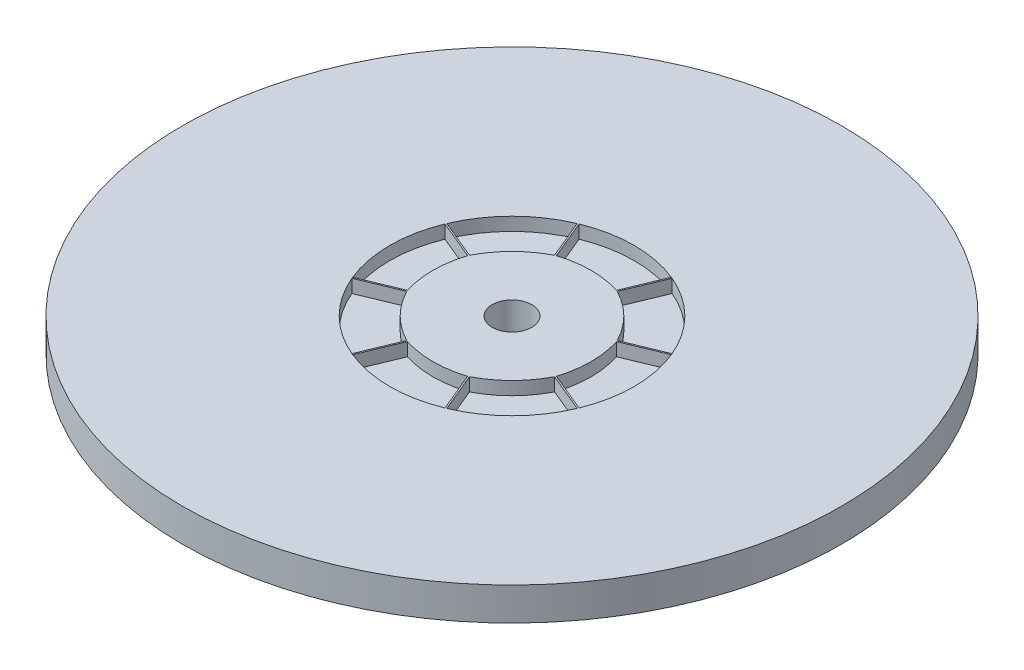
from build123d import *

# Parameters (mm, degrees)
SKETCH1_W          = 470
SKETCH1_H          = 50
CUT_EXTRUDE1_DEPTH = 20
CUT_EXTRUDE2_DEPTH = 20


with BuildPart() as part:
    # Sketch1 → Revolve1 (revolve)
    with BuildSketch(Plane(origin=(0, 0, 0), x_dir=(0, 0, -1), z_dir=(1, 0, 0))):
        with Locations((-265, 0)):
            Rectangle(SKETCH1_W, SKETCH1_H)
    revolve(axis=Axis((0, 285.555555556, 0), (0, -1, 0)))

    # Sketch2 → Cut-Extrude1 (cut)
    with BuildSketch(Plane.XZ.offset(25)):
        with BuildLine():
            Line((-180, 446.476151588), (-122.573000413, 307.835110337))
            ThreePointArc((-122.573000413, 307.835110337), (0, 330), (122.573000413, 307.835110337))
            Line((122.573000413, 307.835110337), (180, 446.476151588))
            ThreePointArc((180, 446.476151588), (0, 480), (-180, 446.476151588))
        make_face()
        with BuildLine():
            Line((188.427093812, 442.985535039), (131.000094225, 304.344493789))
            ThreePointArc((131.000094225, 304.344493789), (233.345237792, 233.345237792), (304.344493789, 131.000094225))
            Line((304.344493789, 131.000094225), (442.985535039, 188.427093812))
            ThreePointArc((442.985535039, 188.427093812), (339.41125497, 339.41125497), (188.427093812, 442.985535039))
        make_face()
        with BuildLine():
            Line((446.476151588, 180), (307.835110337, 122.573000413))
            ThreePointArc((307.835110337, 122.573000413), (330, 0), (307.835110337, -122.573000413))
            Line((307.835110337, -122.573000413), (446.476151588, -180))
            ThreePointArc((446.476151588, -180), (480, 0), (446.476151588, 180))
        make_face()
        with BuildLine():
            Line((442.985535039, -188.427093812), (304.344493789, -131.000094225))
            ThreePointArc((304.344493789, -131.000094225), (233.345237792, -233.345237792), (131.000094225, -304.344493789))
            Line((131.000094225, -304.344493789), (188.427093812, -442.985535039))
            ThreePointArc((188.427093812, -442.985535039), (339.41125497, -339.41125497), (442.985535039, -188.427093812))
        make_face()
        with BuildLine():
            Line((180, -446.476151588), (122.573000413, -307.835110337))
            ThreePointArc((122.573000413, -307.835110337), (0, -330), (-122.573000413, -307.835110337))
            Line((-122.573000413, -307.835110337), (-180, -446.476151588))
            ThreePointArc((-180, -446.476151588), (0, -480), (180, -446.476151588))
        make_face()
        with BuildLine():
            Line((-188.427093812, -442.985535039), (-131.000094225, -304.344493789))
            ThreePointArc((-131.000094225, -304.344493789), (-233.345237792, -233.345237792), (-304.344493789, -131.000094225))
            Line((-304.344493789, -131.000094225), (-442.985535039, -188.427093812))
            ThreePointArc((-442.985535039, -188.427093812), (-339.41125497, -339.41125497), (-188.427093812, -442.985535039))
        make_face()
        with BuildLine():
            Line((-446.476151588, -180), (-307.835110337, -122.573000413))
            ThreePointArc((-307.835110337, -122.573000413), (-330, 0), (-307.835110337, 122.573000413))
            Line((-307.835110337, 122.573000413), (-446.476151588, 180))
            ThreePointArc((-446.476151588, 180), (-480, 0), (-446.476151588, -180))
        make_face()
        with BuildLine():
            Line((-442.985535039, 188.427093812), (-304.344493789, 131.000094225))
            ThreePointArc((-304.344493789, 131.000094225), (-233.345237792, 233.345237792), (-131.000094225, 304.344493789))
            Line((-131.000094225, 304.344493789), (-188.427093812, 442.985535039))
            ThreePointArc((-188.427093812, 442.985535039), (-339.41125497, 339.41125497), (-442.985535039, 188.427093812))
        make_face()
    extrude(amount=-CUT_EXTRUDE1_DEPTH, mode=Mode.SUBTRACT)

    # Sketch3 → Cut-Extrude2 (cut)
    with BuildSketch(Plane(origin=(0, 25, 0), x_dir=(1, 0, 0), z_dir=(0, 1, 0))):
        with BuildLine():
            Line((-45.632403393, 112.890460705), (-70, 171.719042916))
            ThreePointArc((-70, 171.719042916), (0, 185.438479556), (70, 171.719042916))
            Line((70, 171.719042916), (45.632403393, 112.890460705))
            ThreePointArc((45.632403393, 112.890460705), (0, 120), (-45.632403393, 112.890460705))
        make_face()
        with BuildLine():
            Line((112.092592177, 47.558628415), (170.921174388, 71.926225022))
            ThreePointArc((170.921174388, 71.926225022), (131.124806387, 131.124806387), (71.926225022, 170.921174388))
            Line((71.926225022, 170.921174388), (47.558628415, 112.092592177))
            ThreePointArc((47.558628415, 112.092592177), (84.852813742, 84.852813742), (112.092592177, 47.558628415))
        make_face()
        with BuildLine():
            Line((112.890460705, -45.632403393), (171.719042916, -70))
            ThreePointArc((171.719042916, -70), (185.438479556, 0), (171.719042916, 70))
            Line((171.719042916, 70), (112.890460705, 45.632403393))
            ThreePointArc((112.890460705, 45.632403393), (120, 0), (112.890460705, -45.632403393))
        make_face()
        with BuildLine():
            Line((47.558628415, -112.092592177), (71.926225022, -170.921174388))
            ThreePointArc((71.926225022, -170.921174388), (131.124806387, -131.124806387), (170.921174388, -71.926225022))
            Line((170.921174388, -71.926225022), (112.092592177, -47.558628415))
            ThreePointArc((112.092592177, -47.558628415), (84.852813742, -84.852813742), (47.558628415, -112.092592177))
        make_face()
        with BuildLine():
            Line((-45.632403393, -112.890460705), (-70, -171.719042916))
            ThreePointArc((-70, -171.719042916), (0, -185.438479556), (70, -171.719042916))
            Line((70, -171.719042916), (45.632403393, -112.890460705))
            ThreePointArc((45.632403393, -112.890460705), (0, -120), (-45.632403393, -112.890460705))
        make_face()
        with BuildLine():
            Line((-112.092592177, -47.558628415), (-170.921174388, -71.926225022))
            ThreePointArc((-170.921174388, -71.926225022), (-131.124806387, -131.124806387), (-71.926225022, -170.921174388))
            Line((-71.926225022, -170.921174388), (-47.558628415, -112.092592177))
            ThreePointArc((-47.558628415, -112.092592177), (-84.852813742, -84.852813742), (-112.092592177, -47.558628415))
        make_face()
        with BuildLine():
            Line((-112.890460705, 45.632403393), (-171.719042916, 70))
            ThreePointArc((-171.719042916, 70), (-185.438479556, 0), (-171.719042916, -70))
            Line((-171.719042916, -70), (-112.890460705, -45.632403393))
            ThreePointArc((-112.890460705, -45.632403393), (-120, 0), (-112.890460705, 45.632403393))
        make_face()
        with BuildLine():
            Line((-47.558628415, 112.092592177), (-71.926225022, 170.921174388))
            ThreePointArc((-71.926225022, 170.921174388), (-131.124806387, 131.124806387), (-170.921174388, 71.926225022))
            Line((-170.921174388, 71.926225022), (-112.092592177, 47.558628415))
            ThreePointArc((-112.092592177, 47.558628415), (-84.852813742, 84.852813742), (-47.558628415, 112.092592177))
        make_face()
    extrude(amount=-CUT_EXTRUDE2_DEPTH, mode=Mode.SUBTRACT)


solid = part.part
